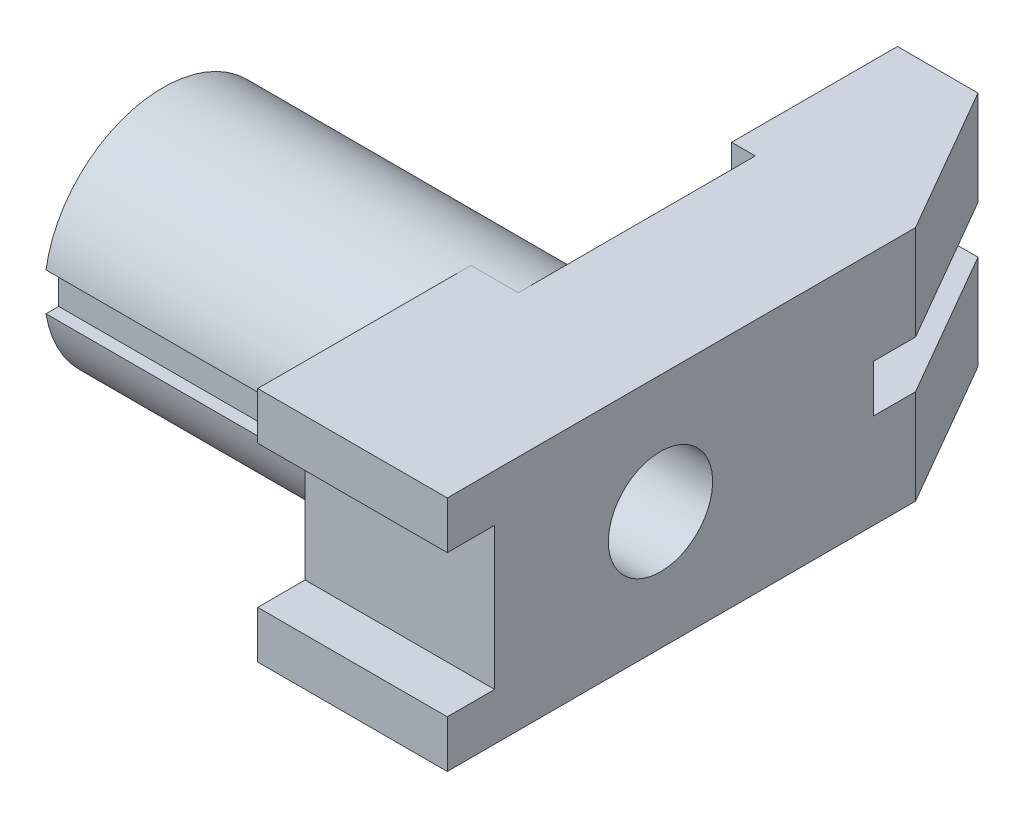
from build123d import *

# Parameters (mm, degrees)
EXTRUDE_1_DEPTH     = 25
CUT_EXTRUDE_1_REACH = 170.967
SKETCH_3_W          = 40
SKETCH_3_H          = 10
SKETCH_3_W_2        = 10
SKETCH_3_H_2        = 30
CUT_EXTRUDE_2_DEPTH = 75
CUT_EXTRUDE_3_DEPTH = 65
CUT_EXTRUDE_4_DEPTH = 4
SKETCH_8_R          = 18
CUT_EXTRUDE_5_DEPTH = 53
CUT_EXTRUDE_6_REACH = 144.597
SKETCH_9_R          = 11


with BuildPart() as part:
    # Эскиз1 → Бобышка-Вытянуть1 (new, symmetric)
    with BuildSketch(Plane(origin=(0, 0, 0), x_dir=(1, 0, 0), z_dir=(0, 1, 0))):
        Polygon((0, 0), (0, 98.823085464), (-18, 130), (-35, 130), (-35, 95), (-30, 95), (-30, 89.524477305), (-30, 70), (-105, 70), (-105, 20), (-40, 20), (-40, 0), align=None)
    extrude(amount=EXTRUDE_1_DEPTH, both=True)

    # Эскиз3 → Вырез-Вытянуть1 (cut, up to next)
    with BuildSketch(Plane(origin=(0, 0, 0), x_dir=(0, 0, -1), z_dir=(1, 0, 0)), mode=Mode.PRIVATE) as cut_extrude_1_sk1:
        with Locations((110, 0)):
            Rectangle(SKETCH_3_W, SKETCH_3_H)
    cut_extrude_1_tool1 = extrude(cut_extrude_1_sk1.sketch, amount=-CUT_EXTRUDE_1_REACH, mode=Mode.PRIVATE) & part.part
    # Эскиз3 → Вырез-Вытянуть1 (cut, up to next)
    with BuildSketch(Plane(origin=(0, 0, 0), x_dir=(0, 0, -1), z_dir=(1, 0, 0)), mode=Mode.PRIVATE) as cut_extrude_1_sk2:
        with Locations((5, 0)):
            Rectangle(SKETCH_3_W_2, SKETCH_3_H_2)
    cut_extrude_1_tool2 = extrude(cut_extrude_1_sk2.sketch, amount=-CUT_EXTRUDE_1_REACH, mode=Mode.PRIVATE) & part.part
    add(cut_extrude_1_tool1.solids().sort_by_distance((0, 0, -110))[0], mode=Mode.SUBTRACT)
    add(cut_extrude_1_tool2.solids().sort_by_distance((0, 0, -5))[0], mode=Mode.SUBTRACT)

    # Эскиз4 → Вырез-Вытянуть2 (cut)
    with BuildSketch(Plane.ZY.offset(105)):
        with BuildLine():
            Line((-70, -25), (-45, -25))
            ThreePointArc((-45, -25), (-62.677669515, -17.677669545), (-70, -4.2e-08))
            Line((-70, -4.2e-08), (-70, -25))
        make_face()
        with BuildLine():
            Line((-70, 25), (-70, -4.2e-08))
            ThreePointArc((-70, -4.2e-08), (-62.677669545, 17.677669515), (-45, 25))
            Line((-45, 25), (-70, 25))
        make_face()
    extrude(amount=-CUT_EXTRUDE_2_DEPTH, mode=Mode.SUBTRACT)

    # Эскиз6 → Вырез-Вытянуть3 (cut)
    with BuildSketch(Plane.ZY.offset(105)):
        with BuildLine():
            ThreePointArc((-20, 0), (-27.32233047, -17.67766953), (-45, -25))
            Line((-45, -25), (-20, -25))
            Line((-20, -25), (-20, 0))
        make_face()
        with BuildLine():
            ThreePointArc((-45, 25), (-27.32233047, 17.67766953), (-20, 0))
            Line((-20, 0), (-20, 25))
            Line((-20, 25), (-45, 25))
        make_face()
    extrude(amount=-CUT_EXTRUDE_3_DEPTH, mode=Mode.SUBTRACT)

    # Эскиз7 → Вырез-Вытянуть4 (cut, symmetric)
    with BuildSketch(Plane(origin=(0, 0, 0), x_dir=(1, 0, 0), z_dir=(0, 1, 0))):
        with BuildLine():
            Line((-105, 23), (-105, 20))
            Line((-105, 20), (-62.141428429, 20))
            ThreePointArc((-62.141428429, 20), (-58.872983346, 22.219544457), (-55, 23))
            Line((-55, 23), (-105, 23))
        make_face()
        with BuildLine():
            ThreePointArc((-55, 23), (-58.872983346, 22.219544457), (-62.141428429, 20))
            Line((-62.141428429, 20), (-55, 20))
            Line((-55, 20), (-55, 23))
        make_face()
        with BuildLine():
            ThreePointArc((-47.858571571, 20), (-51.127016654, 22.219544457), (-55, 23))
            Line((-55, 23), (-55, 20))
            Line((-55, 20), (-47.858571571, 20))
        make_face()
    extrude(amount=CUT_EXTRUDE_4_DEPTH, both=True, mode=Mode.SUBTRACT)

    # Эскиз8 → Вырез-Вытянуть5 (cut)
    with BuildSketch(Plane.ZY.offset(105)):
        with Locations((-45, 0)):
            Circle(SKETCH_8_R)
    extrude(amount=-CUT_EXTRUDE_5_DEPTH, mode=Mode.SUBTRACT)

    # Эскиз9 → Вырез-Вытянуть6 (cut, up to next)
    with BuildSketch(Plane.ZY.offset(52), mode=Mode.PRIVATE) as cut_extrude_6_sk1:
        with Locations((-45, 0)):
            Circle(SKETCH_9_R)
    cut_extrude_6_tool1 = extrude(cut_extrude_6_sk1.sketch, amount=-CUT_EXTRUDE_6_REACH, mode=Mode.PRIVATE) & part.part
    add(cut_extrude_6_tool1.solids().sort_by_distance((-52, 0, -45))[0], mode=Mode.SUBTRACT)


solid = part.part
